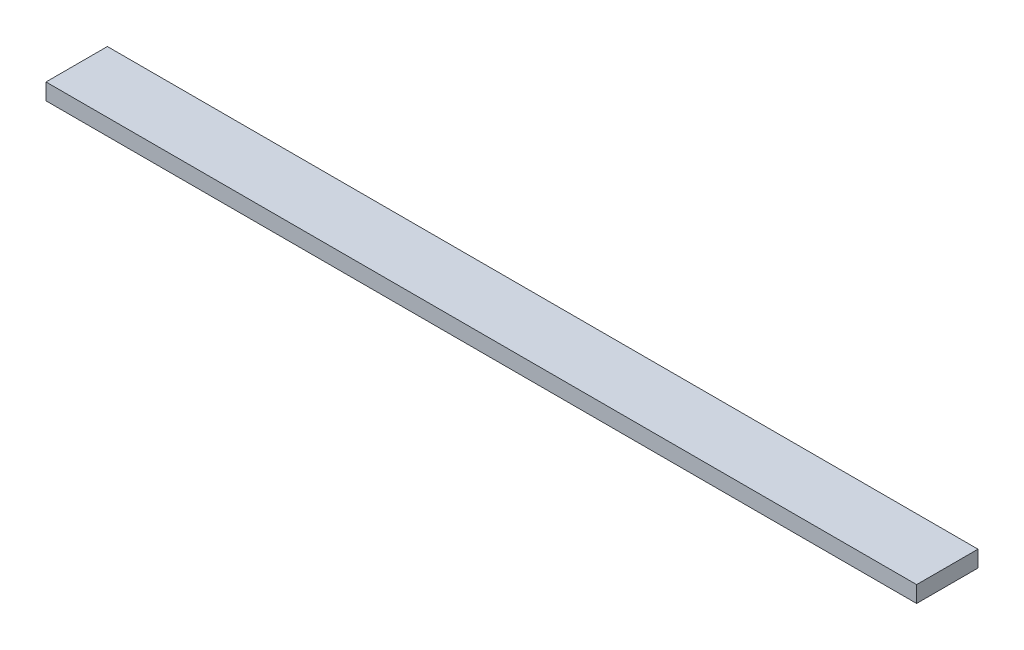
from build123d import *

# Parameters (mm, degrees)
SKETCH1_W           = 212.750000014
SKETCH1_H           = 15
BOSS_EXTRUDE1_DEPTH = 4


with BuildPart() as part:
    # Sketch1 → Boss-Extrude1 (new body)
    with BuildSketch(Plane(origin=(0, 0, 0), x_dir=(1, 0, 0), z_dir=(0, 1, 0))):
        Rectangle(SKETCH1_W, SKETCH1_H)
    extrude(amount=BOSS_EXTRUDE1_DEPTH)


solid = part.part
